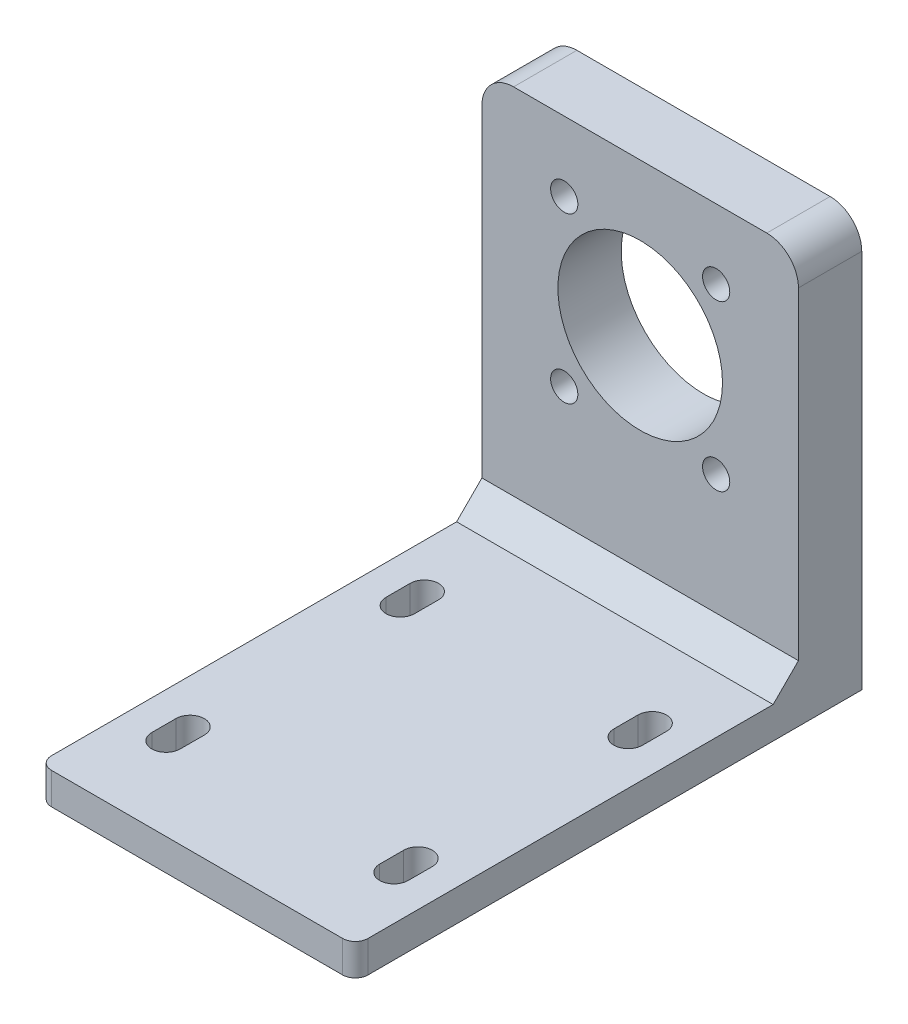
from build123d import *

# Parameters (mm, degrees)
SKETCH_1_R               = 2.15
EXTRUDE_1_DEPTH          = 10
SKETCH_2_W               = 50
SKETCH_2_H               = 10
EXTRUDE_2_DEPTH          = 5
SKETCH_3_W               = 50
SKETCH_3_H               = 5
EXTRUDE_3_DEPTH          = 70
CUT_EXTRUDE_1_DEPTH      = 104.07764064
CUT_EXTRUDE_1_DEPTH_BACK = 20
FILLET_1_R               = 5
FILLET_2_R               = 2
SKETCH_9_W               = 4
SKETCH_9_H               = 4
EXTRUDE_4_DEPTH          = 4
SKETCH_13_W              = 4
SKETCH_13_H              = 4
EXTRUDE_6_DEPTH          = 46
CUT_EXTRUDE_2_DEPTH      = 101.623058987


with BuildPart() as part:
    # 草图1 → 凸台-拉伸1 (new body)
    # profile 1 of 3: a face of its own
    with BuildSketch(Plane.XY):
        with BuildLine():
            Line((13, 6), (25, 6))
            Line((25, 6), (25, 30))
            Line((25, 30), (0, 30))
            Line((0, 30), (0, 19))
            ThreePointArc((0, 19), (9.192388155, 15.192388155), (13, 6))
        make_face()
        with Locations((12, 19)):
            Circle(SKETCH_1_R, mode=Mode.SUBTRACT)
    # profile 2 of 3: a face of its own
    with BuildSketch(Plane.XY):
        with BuildLine():
            Line((-25, 19), (-25, 6))
            Line((-25, 6), (-13, 6))
            ThreePointArc((-13, 6), (-9.192388155, 15.192388155), (0, 19))
            Line((0, 19), (0, 30))
            Line((0, 30), (-25, 30))
            Line((-25, 30), (-25, 19))
        make_face()
        with Locations((-12, 19)):
            Circle(SKETCH_1_R, mode=Mode.SUBTRACT)
    # profile 3 of 3: a face of its own
    with BuildSketch(Plane.XY):
        with BuildLine():
            Line((-25, -30), (25, -30))
            Line((25, -30), (25, -27))
            Line((25, -27), (25, -7))
            Line((25, -7), (25, 6))
            Line((25, 6), (13, 6))
            ThreePointArc((13, 6), (0, -7), (-13, 6))
            Line((-13, 6), (-25, 6))
            Line((-25, 6), (-25, -30))
        make_face()
        with Locations((-12, -7)):
            Circle(SKETCH_1_R, mode=Mode.SUBTRACT)
        with Locations((12, -7)):
            Circle(SKETCH_1_R, mode=Mode.SUBTRACT)
    extrude(amount=EXTRUDE_1_DEPTH)

    # 草图2 → 凸台-拉伸2 (add)
    with BuildSketch(Plane.XZ.offset(30)):
        with Locations((0, 5)):
            Rectangle(SKETCH_2_W, SKETCH_2_H)
    extrude(amount=EXTRUDE_2_DEPTH)

    # 草图3 → 凸台-拉伸3 (add)
    with BuildSketch(Plane.XY.offset(10)):
        with Locations((0, -32.5)):
            Rectangle(SKETCH_3_W, SKETCH_3_H)
    extrude(amount=EXTRUDE_3_DEPTH)

    # 草图8 → 切除-拉伸1 (cut, two sides: drawn at the far end of the back side and taken through both)
    with BuildSketch(Plane(origin=(0, -30, 0), x_dir=(1, 0, 0), z_dir=(0, 1, 0)).offset(-CUT_EXTRUDE_1_DEPTH_BACK)):
        with BuildLine():
            Line((-20.25, -66.9), (-20.25, -63.1))
            ThreePointArc((-20.25, -63.1), (-18, -60.85), (-15.75, -63.1))
            Line((-15.75, -63.1), (-15.75, -66.9))
            ThreePointArc((-15.75, -66.9), (-18, -69.15), (-20.25, -66.9))
        make_face()
        with BuildLine():
            Line((-15.75, -26.1), (-15.75, -29.9))
            ThreePointArc((-15.75, -29.9), (-18, -32.15), (-20.25, -29.9))
            Line((-20.25, -29.9), (-20.25, -26.1))
            ThreePointArc((-20.25, -26.1), (-18, -23.85), (-15.75, -26.1))
        make_face()
        with BuildLine():
            Line((20.25, -66.9), (20.25, -63.1))
            ThreePointArc((20.25, -63.1), (18, -60.85), (15.75, -63.1))
            Line((15.75, -63.1), (15.75, -66.9))
            ThreePointArc((15.75, -66.9), (18, -69.15), (20.25, -66.9))
        make_face()
        with BuildLine():
            Line((15.75, -26.1), (15.75, -29.9))
            ThreePointArc((15.75, -29.9), (18, -32.15), (20.25, -29.9))
            Line((20.25, -29.9), (20.25, -26.1))
            ThreePointArc((20.25, -26.1), (18, -23.85), (15.75, -26.1))
        make_face()
    extrude(amount=CUT_EXTRUDE_1_DEPTH + CUT_EXTRUDE_1_DEPTH_BACK, mode=Mode.SUBTRACT)

    # 圆角1
    fillet_1_edges = [part.edges().sort_by_distance(p)[0] for p in [
        (-25, 30, 5),
        (25, 30, 5),
    ]]
    fillet(fillet_1_edges, radius=FILLET_1_R)

    # 圆角2
    fillet_2_edges = [part.edges().sort_by_distance(p)[0] for p in [
        (25, -32.5, 80),
        (-25, -32.5, 80),
    ]]
    fillet(fillet_2_edges, radius=FILLET_2_R)

    # 草图9 → 凸台-拉伸4 (add)
    with BuildSketch(Plane(origin=(0, -30, 0), x_dir=(1, 0, 0), z_dir=(0, 1, 0))):
        with Locations((23, -12)):
            Rectangle(SKETCH_9_W, SKETCH_9_H)
    extrude(amount=EXTRUDE_4_DEPTH)

    # 草图13 → 凸台-拉伸6 (add)
    with BuildSketch(Plane.ZY.offset(-21)):
        with Locations((12, -28)):
            Rectangle(SKETCH_13_W, SKETCH_13_H)
    extrude(amount=EXTRUDE_6_DEPTH)

    # 草图14 → 切除-拉伸2 (cut, through all)
    with BuildSketch(Plane(origin=(25, 0, 0), x_dir=(0, 0, -1), z_dir=(1, 0, 0))):
        Polygon((-10, -26), (-14, -30), (-14, -26), align=None)
    extrude(amount=-CUT_EXTRUDE_2_DEPTH, mode=Mode.SUBTRACT)


solid = part.part
